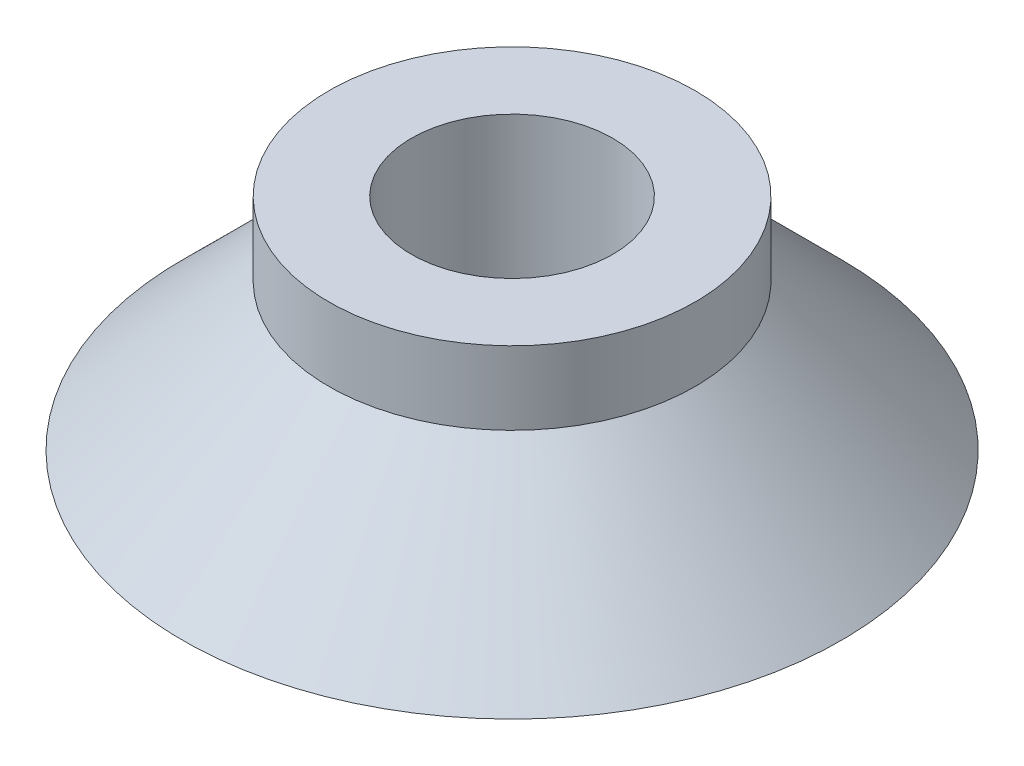
from build123d import *


with BuildPart() as part:
    # Эскиз1 → Повернуть1 (revolve)
    with BuildSketch(Plane.XY, mode=Mode.PRIVATE) as revolve_1_sk:
        Polygon((5, 0), (5, 4), (5, 6), (2.75, 6), (2.75, 0), align=None)
        Polygon((9, 0), (5, 4), (5, 0), align=None)
    revolve(revolve_1_sk.sketch.rotate(Axis((0, 0, 0), (0, 1, 0)), 90), axis=Axis((0, 0, 0), (0, 1, 0)))


solid = part.part
